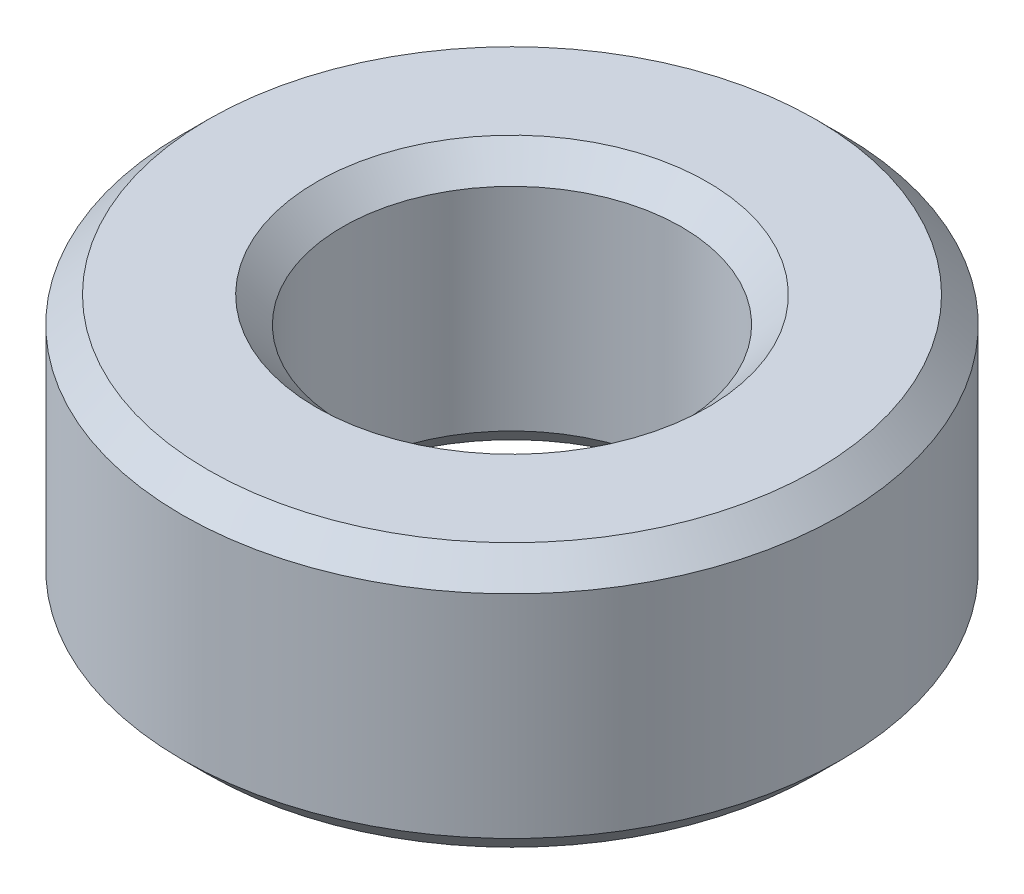
from build123d import *

# Parameters (mm, degrees)
SKETCH1_R                = 6.35
BOSS_EXTRUDE1_DEPTH      = 5.08
F_0_257_DIAMETER_HOLE1_D = 6.5278
CHAMFER1_SIZE            = 0.5


with BuildPart() as part:
    # Sketch1 → Boss-Extrude1 (new body)
    with BuildSketch(Plane(origin=(0, 0, 0), x_dir=(1, 0, 0), z_dir=(0, 1, 0))):
        with Locations(Location((0, 0, 0), (0, 0, 270))):
            Circle(SKETCH1_R)
    extrude(amount=BOSS_EXTRUDE1_DEPTH)

    # F (0.257) Diameter Hole1 (through all)
    with Locations(Plane(origin=(0, 5.08, 0), x_dir=(1, 0, 0), z_dir=(0, 1, 0))):
        with Locations((0, 0)):
            Hole(F_0_257_DIAMETER_HOLE1_D / 2)

    # Chamfer1
    chamfer1_edges = [part.edges().sort_by_distance(p)[0] for p in [
        (0, 0, -6.35),
        (0, 5.08, -6.35),
        (3.2639, 5.08, 0),
        (3.2639, 0, 0),
    ]]
    chamfer(chamfer1_edges, length=CHAMFER1_SIZE)


solid = part.part
